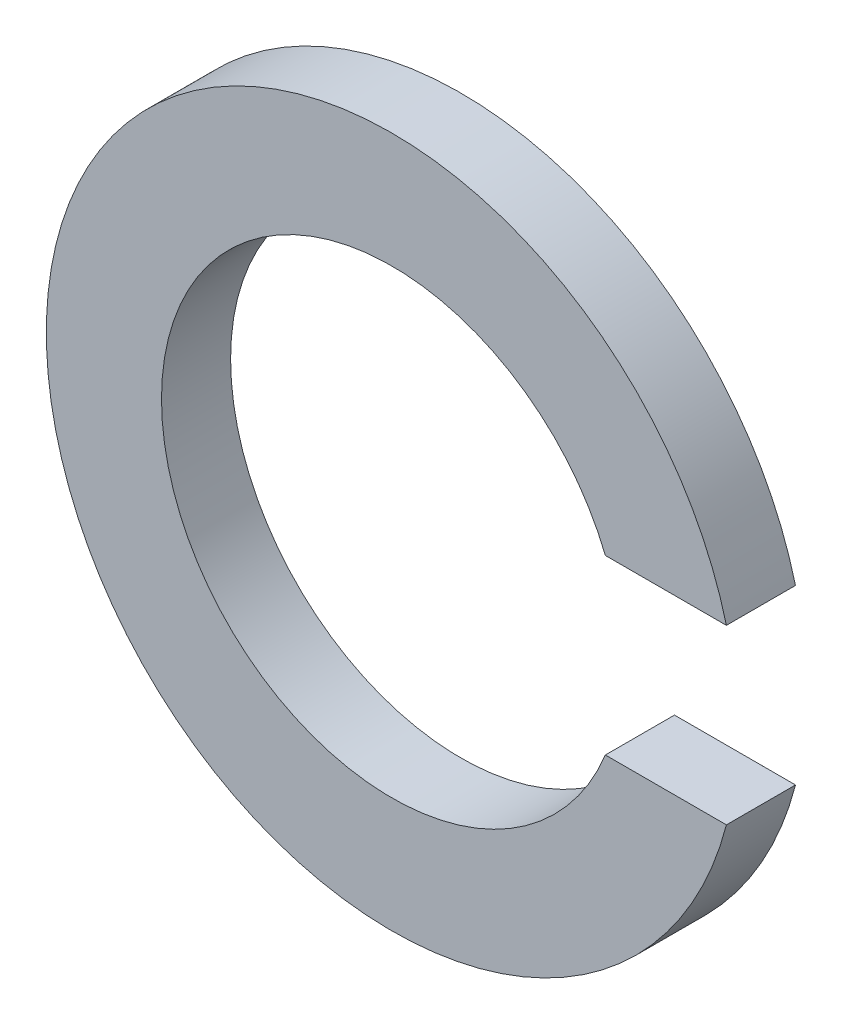
from build123d import *

# Parameters (mm, degrees)
BOSS_EXTRUDE1_DEPTH = 0.6


with BuildPart() as part:
    # Sketch1 → Boss-Extrude1 (new body)
    with BuildSketch(Plane.XY):
        with BuildLine():
            Line((1.854049622, 0.75), (2.90473751, 0.75))
            ThreePointArc((2.90473751, 0.75), (-3, 0), (2.90473751, -0.75))
            Line((2.90473751, -0.75), (1.854049622, -0.75))
            ThreePointArc((1.854049622, -0.75), (-2, 0), (1.854049622, 0.75))
        make_face()
    extrude(amount=BOSS_EXTRUDE1_DEPTH)


solid = part.part
